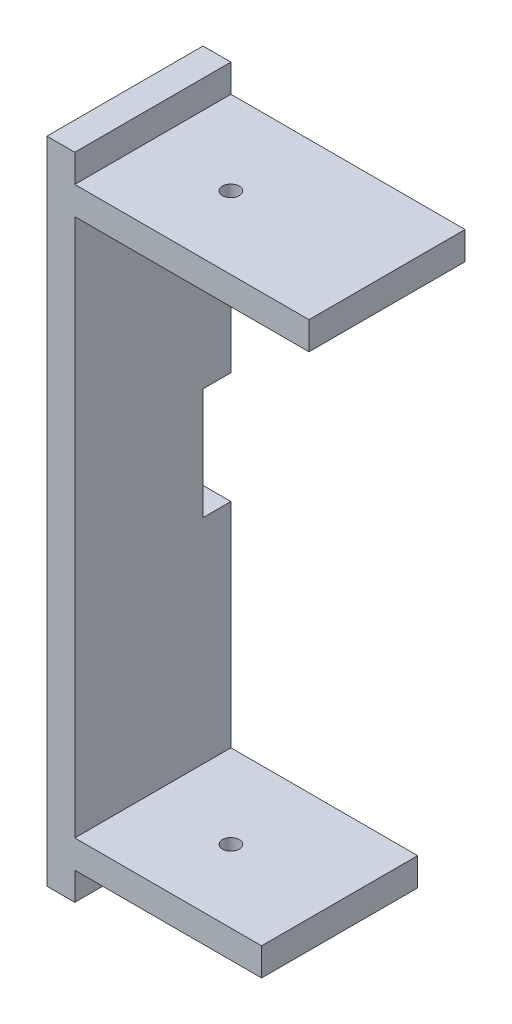
from build123d import *

# Parameters (mm, degrees)
EXTRUDE_1_DEPTH     = 28
SKETCH_2_W          = 5
SKETCH_2_H          = 20
CUT_EXTRUDE_1_DEPTH = 5
SKETCH_3_R          = 1.5
CUT_EXTRUDE_2_DEPTH = 118.553755913


with BuildPart() as part:
    # 草圖1 → 填料-伸長1 (new body)
    with BuildSketch(Plane.XY):
        Polygon((-17.451364004, -6.196122823), (-17.451364004, -11.196122823), (-22.451364004, -11.196122823), (-22.451364004, 105.303877177), (-17.451364004, 105.303877177), (-17.451364004, 100.303877177), (24.548635996, 100.303877177), (24.548635996, 95.303877177), (-17.451364004, 95.303877177), (-17.451364004, -1.196122823), (16.048635996, -1.196122823), (16.048635996, -6.196122823), align=None)
    extrude(amount=EXTRUDE_1_DEPTH)

    # 草圖2 → 除料-伸長1 (cut)
    with BuildSketch(Plane(origin=(0, 0, 0), x_dir=(-1, 0, 0), z_dir=(0, 0, -1))):
        with Locations((19.951364004, 47.053877177)):
            Rectangle(SKETCH_2_W, SKETCH_2_H)
    extrude(amount=-CUT_EXTRUDE_1_DEPTH, mode=Mode.SUBTRACT)

    # 草圖3 → 除料-伸長2 (cut, through all)
    with BuildSketch(Plane.XZ.offset(6.196122823)):
        with Locations(Location((-2.451364004, 15, 0), (0, 0, 270))):
            Circle(SKETCH_3_R)
    extrude(amount=-CUT_EXTRUDE_2_DEPTH, mode=Mode.SUBTRACT)


solid = part.part
